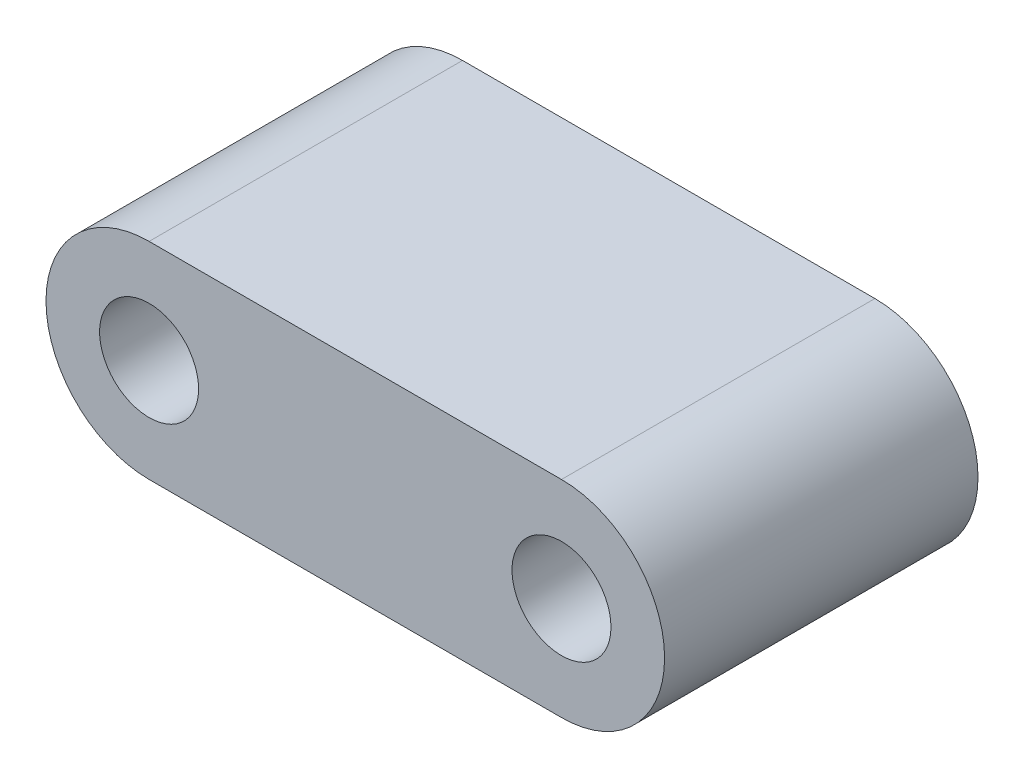
from build123d import *

# Parameters (mm, degrees)
SKETCH1_R           = 6
BOSS_EXTRUDE1_DEPTH = 19
SKETCH2_R           = 6
CUT_EXTRUDE1_DEPTH  = 12.5


with BuildPart() as part:
    # Sketch1 → Boss-Extrude1 (new, symmetric)
    with BuildSketch(Plane.XY):
        with BuildLine():
            Line((0, 12.5), (50, 12.5))
            ThreePointArc((50, 12.5), (62.5, 0), (50, -12.5))
            Line((50, -12.5), (0, -12.5))
            ThreePointArc((0, -12.5), (-12.5, 0), (0, 12.5))
        make_face()
        Circle(SKETCH1_R, mode=Mode.SUBTRACT)
        with Locations((50, 0)):
            Circle(SKETCH1_R, mode=Mode.SUBTRACT)
    extrude(amount=BOSS_EXTRUDE1_DEPTH, both=True)

    # Sketch2 → Cut-Extrude1 (cut)
    with BuildSketch(Plane.XZ.offset(12.5)):
        with Locations(Location((25, 0, 0), (0, 0, 270))):
            Circle(SKETCH2_R)
    extrude(amount=-CUT_EXTRUDE1_DEPTH, mode=Mode.SUBTRACT)


solid = part.part
